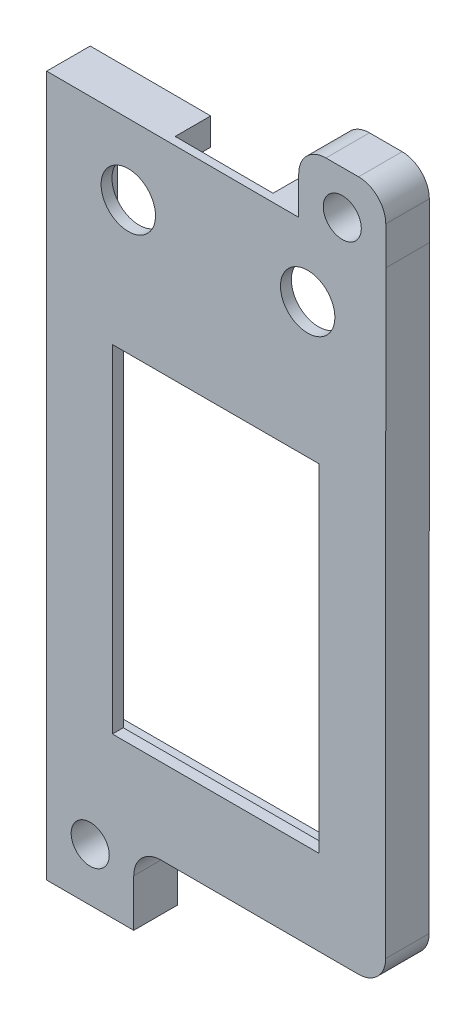
from build123d import *

# Parameters (mm, degrees)
SKETCH1_R           = 1.75
BOSS_EXTRUDE1_DEPTH = 1
SKETCH2_R           = 1.75
BOSS_EXTRUDE2_DEPTH = 2
SKETCH3_R           = 2.5
SKETCH3_R_2         = 1.75
SKETCH3_W           = 19
SKETCH3_H           = 31
BOSS_EXTRUDE3_DEPTH = 1
SKETCH5_W           = 3.6
SKETCH5_H           = 4.6
CUT_EXTRUDE1_DEPTH  = 21
SKETCH6_W           = 8.995193627
SKETCH6_H           = 3.264834395
CUT_EXTRUDE2_DEPTH  = 21


with BuildPart() as part:
    # Sketch1 → Boss-Extrude1 (new body)
    with BuildSketch(Plane.XY):
        with BuildLine():
            Line((-14.676171507, 8), (-6.676171507, 8))
            Line((-6.676171507, 8), (-6.676171507, 12.347767597))
            ThreePointArc((-6.676171507, 12.347767597), (-5.943059576, 14.116412996), (-4.173686267, 14.847766361))
            Line((-4.173686267, 14.847766361), (13.97122522, 14.82972857))
            ThreePointArc((13.97122522, 14.82972857), (15.740392314, 15.560875949), (16.473710392, 17.329144394))
            Line((16.473710392, 17.329144394), (16.486530072, 72.307640303))
            Line((16.486530072, 72.307640303), (16.486530072, 75.807640303))
            ThreePointArc((16.486530072, 75.807640303), (15.754297025, 77.575407256), (13.986530072, 78.307640303))
            Line((13.986530072, 78.307640303), (10.986530072, 78.307640303))
            ThreePointArc((10.986530072, 78.307640303), (9.218763119, 77.575407256), (8.486530072, 75.807640303))
            Line((8.486530072, 75.807640303), (8.486530072, 72.327883256))
            Line((8.486530072, 72.327883256), (-14.676171507, 72.386493441))
            Line((-14.676171507, 72.386493441), (-14.676171507, 8))
        make_face()
        with Locations((12.486998677, 74.317766997)):
            Circle(SKETCH1_R, mode=Mode.SUBTRACT)
        with Locations((-10.676171507, 12.854229471)):
            Circle(SKETCH1_R, mode=Mode.SUBTRACT)
        Polygon((-12.176171507, 17.355722839), (13.97371046, 17.329727334), (13.985948537, 69.813959694), (-12.176171507, 69.880159515), align=None, mode=Mode.SUBTRACT)
    extrude(amount=BOSS_EXTRUDE1_DEPTH)

    # Sketch2 → Boss-Extrude2 (add)
    with BuildSketch(Plane.XY.offset(1)):
        with BuildLine():
            Line((-4.173686267, 14.847766361), (13.97122522, 14.82972857))
            ThreePointArc((13.97122522, 14.82972857), (15.740392314, 15.560875949), (16.473710392, 17.329144394))
            Line((16.473710392, 17.329144394), (16.486530072, 72.307640303))
            Line((16.486530072, 72.307640303), (16.486530072, 75.807640303))
            ThreePointArc((16.486530072, 75.807640303), (15.754297025, 77.575407256), (13.986530072, 78.307640303))
            Line((13.986530072, 78.307640303), (10.986530072, 78.307640303))
            ThreePointArc((10.986530072, 78.307640303), (9.218763119, 77.575407256), (8.486530072, 75.807640303))
            Line((8.486530072, 75.807640303), (8.486530072, 72.327883256))
            Line((8.486530072, 72.327883256), (-14.676171507, 72.386493441))
            Line((-14.676171507, 72.386493441), (-14.676171507, 8))
            Line((-14.676171507, 8), (-6.676171507, 8))
            Line((-6.676171507, 8), (-6.676171507, 12.347767597))
            ThreePointArc((-6.676171507, 12.347767597), (-5.943059576, 14.116412996), (-4.173686267, 14.847766361))
        make_face()
        with Locations((12.486998677, 74.317766997)):
            Circle(SKETCH2_R, mode=Mode.SUBTRACT)
        with Locations((-10.676171507, 12.854229471)):
            Circle(SKETCH2_R, mode=Mode.SUBTRACT)
        Polygon((-12.176171507, 21.330224514), (13.974643281, 21.330224514), (13.985948537, 69.813959694), (-12.176171507, 69.880159515), align=None, mode=Mode.SUBTRACT)
    extrude(amount=BOSS_EXTRUDE2_DEPTH)

    # Sketch3 → Boss-Extrude3 (add)
    with BuildSketch(Plane.XY.offset(3)):
        with BuildLine():
            Line((-4.173686267, 14.847766361), (13.97122522, 14.82972857))
            ThreePointArc((13.97122522, 14.82972857), (15.740392314, 15.560875949), (16.473710392, 17.329144394))
            Line((16.473710392, 17.329144394), (16.486530072, 72.307640303))
            Line((16.486530072, 72.307640303), (16.486530072, 75.807640303))
            ThreePointArc((16.486530072, 75.807640303), (15.754297025, 77.575407256), (13.986530072, 78.307640303))
            Line((13.986530072, 78.307640303), (10.986530072, 78.307640303))
            ThreePointArc((10.986530072, 78.307640303), (9.218763119, 77.575407256), (8.486530072, 75.807640303))
            Line((8.486530072, 75.807640303), (8.486530072, 72.327883256))
            Line((8.486530072, 72.327883256), (-14.676171507, 72.386493441))
            Line((-14.676171507, 72.386493441), (-14.676171507, 8))
            Line((-14.676171507, 8), (-6.676171507, 8))
            Line((-6.676171507, 8), (-6.676171507, 12.347767597))
            ThreePointArc((-6.676171507, 12.347767597), (-5.943059576, 14.116412996), (-4.173686267, 14.847766361))
        make_face()
        with Locations((-7.177066698, 65.873523259)):
            Circle(SKETCH3_R, mode=Mode.SUBTRACT)
        with Locations((9.307529554, 66.02592423)):
            Circle(SKETCH3_R, mode=Mode.SUBTRACT)
        with Locations((12.486998677, 74.317766997)):
            Circle(SKETCH3_R_2, mode=Mode.SUBTRACT)
        with Locations((-10.676171507, 12.854229471)):
            Circle(SKETCH3_R_2, mode=Mode.SUBTRACT)
        with Locations((0.861995575, 38.14822724)):
            Rectangle(SKETCH3_W, SKETCH3_H, mode=Mode.SUBTRACT)
    extrude(amount=BOSS_EXTRUDE3_DEPTH)

    # Sketch5 → Cut-Extrude1 (cut)
    with BuildSketch(Plane.ZY.offset(14.676171507)):
        with Locations((0.78983946, 57.439422967)):
            Rectangle(SKETCH5_W, SKETCH5_H)
    extrude(amount=-CUT_EXTRUDE1_DEPTH, mode=Mode.SUBTRACT)

    # Sketch6 → Cut-Extrude2 (cut)
    with BuildSketch(Plane(origin=(0.183069407, 72.348894077, 0), x_dir=(0.9999967986314592, -0.0025303610084290717, 0), z_dir=(0.0025303610084290713, 0.9999967986314591, 0))):
        with Locations((0.710777389, -1.632417198)):
            Rectangle(SKETCH6_W, SKETCH6_H)
    extrude(amount=-CUT_EXTRUDE2_DEPTH, mode=Mode.SUBTRACT)


solid = part.part
